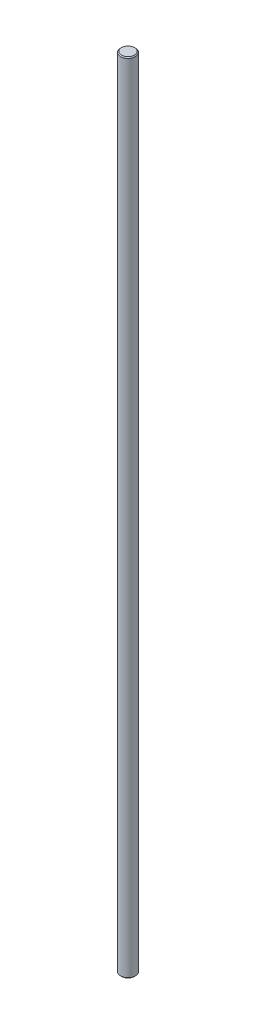
from build123d import *

# Parameters (mm, degrees)
SKETCH1_R           = 4
BOSS_EXTRUDE1_DEPTH = 215
CHAMFER1_SIZE       = 0.5


with BuildPart() as part:
    # Sketch1 → Boss-Extrude1 (new, symmetric)
    with BuildSketch(Plane(origin=(0, 0, 0), x_dir=(1, 0, 0), z_dir=(0, 1, 0))):
        with Locations(Location((0, 0, 0), (0, 0, 270))):
            Circle(SKETCH1_R)
    extrude(amount=BOSS_EXTRUDE1_DEPTH, both=True)

    # Chamfer1
    chamfer1_edges = [part.edges().sort_by_distance(p)[0] for p in [
        (0, -215, -4),
        (0, 215, -4),
    ]]
    chamfer(chamfer1_edges, length=CHAMFER1_SIZE)


solid = part.part
